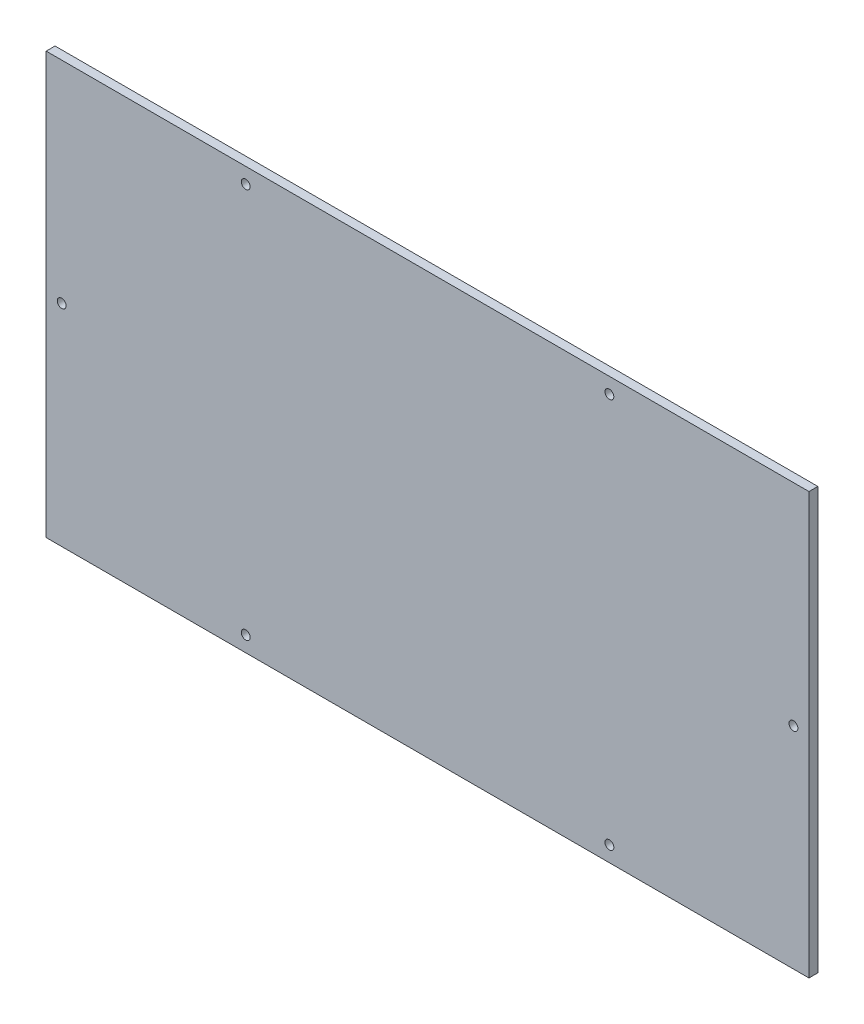
from build123d import *

# Parameters (mm, degrees)
SCHIZZO1_W                   = 344
SCHIZZO1_H                   = 190
SCHIZZO1_R                   = 2
ESTRUSIONE_ESTRUSIONE1_DEPTH = 4


with BuildPart() as part:
    # Schizzo1 → Estrusione-Estrusione1 (new body)
    with BuildSketch(Plane.XY):
        with Locations((-172, 95)):
            Rectangle(SCHIZZO1_W, SCHIZZO1_H)
        with Locations(Location((-90, 183, 0), (0, 0, 180))):
            Circle(SCHIZZO1_R, mode=Mode.SUBTRACT)
        with Locations((-7, 95)):
            Circle(SCHIZZO1_R, mode=Mode.SUBTRACT)
        with Locations((-254, 183)):
            Circle(SCHIZZO1_R, mode=Mode.SUBTRACT)
        with Locations(Location((-337, 95, 0), (0, 0, 180))):
            Circle(SCHIZZO1_R, mode=Mode.SUBTRACT)
        with Locations(Location((-254, 7, 0), (0, 0, 180))):
            Circle(SCHIZZO1_R, mode=Mode.SUBTRACT)
        with Locations((-90, 7)):
            Circle(SCHIZZO1_R, mode=Mode.SUBTRACT)
    extrude(amount=ESTRUSIONE_ESTRUSIONE1_DEPTH)


solid = part.part
